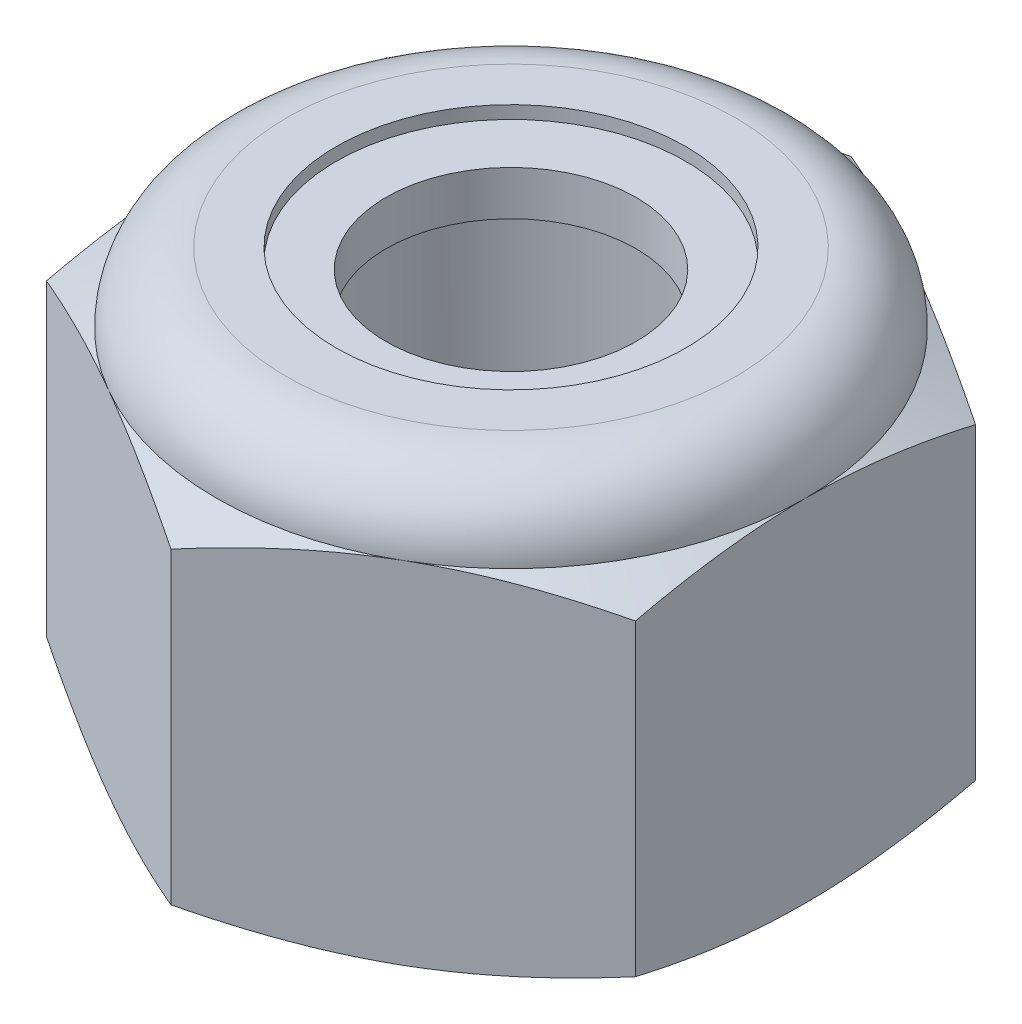
from build123d import *

# Parameters (mm, degrees)
SKETCH1_R      = 2
EXTRUDE1_DEPTH = 5
CHAMFER1_SIZE  = 0.2


with BuildPart() as part:
    # Sketch1 → Extrude1 (new body)
    with BuildSketch(Plane(origin=(0, 0, 0), x_dir=(1, 0, 0), z_dir=(0, 1, 0))):
        Polygon((0, 4.041451884), (-3.5, 2.020725942), (-3.5, -2.020725942), (0, -4.041451884), (3.5, -2.020725942), (3.5, 2.020725942), align=None)
        with Locations(Location((0, 0, 0), (0, 0, 270))):
            Circle(SKETCH1_R, mode=Mode.SUBTRACT)
    extrude(amount=EXTRUDE1_DEPTH)

    # Chamfer1
    chamfer1_edges = [part.edges().sort_by_distance(p)[0] for p in [
        (0, 0, -2),
    ]]
    chamfer(chamfer1_edges, length=CHAMFER1_SIZE)

    # Sketch5 → Cut-Revolve3 (revolve, cut)
    with BuildSketch(Plane(origin=(0, 0, 0), x_dir=(0, 0, -1), z_dir=(1, 0, 0))):
        with BuildLine():
            Line((0, 0), (3.5, 0))
            Line((3.5, 0), (4.041451884, 0.25248316))
            Line((4.041451884, 0.25248316), (4.041451884, 3.914183506))
            Line((4.041451884, 3.914183506), (3.5, 4.166666667))
            ThreePointArc((3.5, 4.166666667), (3.255922318, 4.755922318), (2.666666667, 5))
            Line((2.666666667, 5), (2.666666667, 6.27))
            Line((2.666666667, 6.27), (5.311451884, 6.27))
            Line((5.311451884, 6.27), (5.311451884, -1.27))
            Line((5.311451884, -1.27), (0, -1.27))
            Line((0, -1.27), (0, 0))
        make_face()
    revolve(axis=Axis((0, 0, 0), (0, 1, 0)), mode=Mode.SUBTRACT)

    # Sketch6 → Cut-Revolve4 (revolve, cut)
    with BuildSketch(Plane(origin=(0, 0, 0), x_dir=(0, 0, -1), z_dir=(1, 0, 0))):
        with BuildLine():
            Line((0, 4.166666667), (3.3476, 4.166666667))
            ThreePointArc((3.3476, 4.166666667), (3.148159244, 4.648159244), (2.666666667, 4.8476))
            Line((2.666666667, 4.8476), (2.0762, 4.8476))
            Line((2.0762, 4.8476), (2.0762, 6.27))
            Line((2.0762, 6.27), (0, 6.27))
            Line((0, 6.27), (0, 4.166666667))
        make_face()
    revolve(axis=Axis((0, 6.27, 0), (0, -1, 0)), mode=Mode.SUBTRACT)


with BuildPart() as body_2:
    # Sketch7 → Revolve2 (revolve)
    with BuildSketch(Plane(origin=(0, 0, 0), x_dir=(0, 0, -1), z_dir=(1, 0, 0))):
        with BuildLine():
            Line((1.485733333, 4.242866667), (3.266579964, 4.242866667))
            ThreePointArc((3.266579964, 4.242866667), (3.066430175, 4.620419399), (2.666666667, 4.7714))
            Line((2.666666667, 4.7714), (1.485733333, 4.7714))
            Line((1.485733333, 4.7714), (1.485733333, 4.242866667))
        make_face()
    revolve(axis=Axis((0, 4.242866667, 0), (0, 1, 0)))


solid = Compound([part.part, body_2.part])
